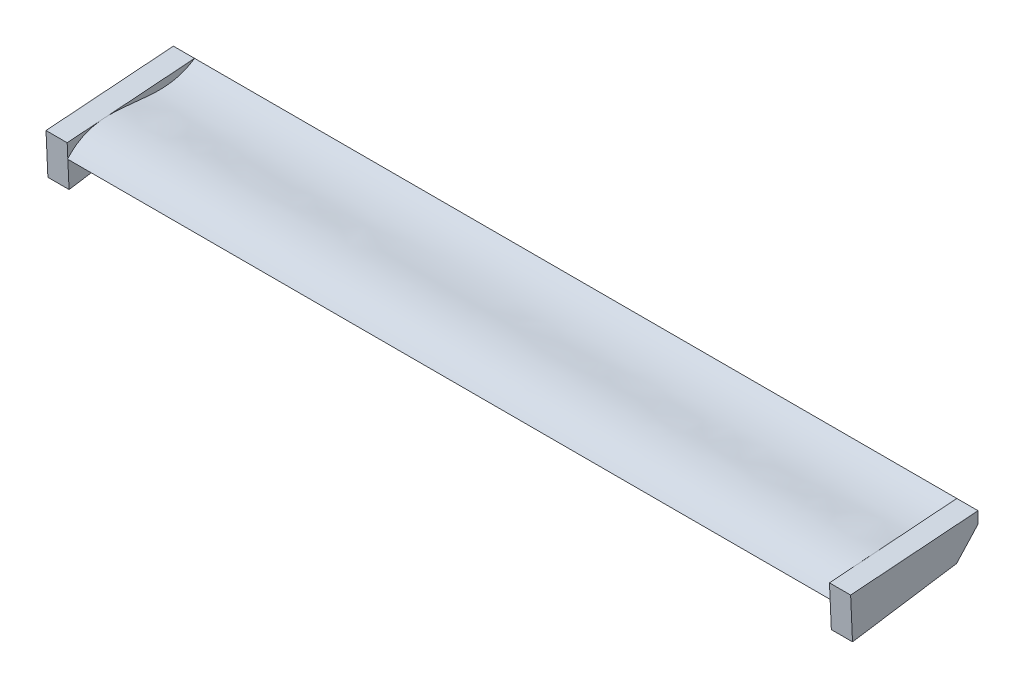
from build123d import *

# Parameters (mm, degrees)
BOSS_EXTRUDE2_DEPTH = 228.6
BOSS_EXTRUDE3_DEPTH = 12.7
BOSS_EXTRUDE4_DEPTH = 12.7


with BuildPart() as part:
    # Sketch5 → Boss-Extrude2 (new, symmetric)
    with BuildSketch(Plane(origin=(0, 0, 0), x_dir=(0, 0, -1), z_dir=(1, 0, 0))):
        with BuildLine():
            add(Edge.make_bspline(
                [(-28.335355673, 0), (-4.22034825, -13.482840601), (29.919203063, -7.409504984), (47.864644327, 14.230029394)],
                knots=[0, 0, 0, 0, 1, 1, 1, 1], degree=3))
            add(Edge.make_bspline(
                [(-28.335355673, 0), (-7.388023191, 23.329729693), (23.952126554, -2.21974241), (47.864644327, 14.230029394)],
                knots=[0, 0, 0, 0, 1, 1, 1, 1], degree=3))
        make_face()
    extrude(amount=BOSS_EXTRUDE2_DEPTH, both=True)

    # Sketch7 → Boss-Extrude3 (add)
    with BuildSketch(Plane(origin=(228.6, 0, 0), x_dir=(0, 0, -1), z_dir=(1, 0, 0))):
        Polygon((47.864644327, 14.230029394), (-28.530543378, 8.593586149), (-27.39909465, -16.298285859), (35.004654405, -6.81152345), (47.864644327, 7.201033869), align=None)
    extrude(amount=BOSS_EXTRUDE3_DEPTH)

    # Sketch8 → Boss-Extrude4 (add)
    with BuildSketch(Plane.ZY.offset(228.6)):
        Polygon((28.530543378, 8.593586149), (27.39909465, -16.298285859), (-35.004654405, -6.81152345), (-47.864644327, 7.201033869), (-47.864644327, 14.230029394), align=None)
    extrude(amount=BOSS_EXTRUDE4_DEPTH)


solid = part.part
